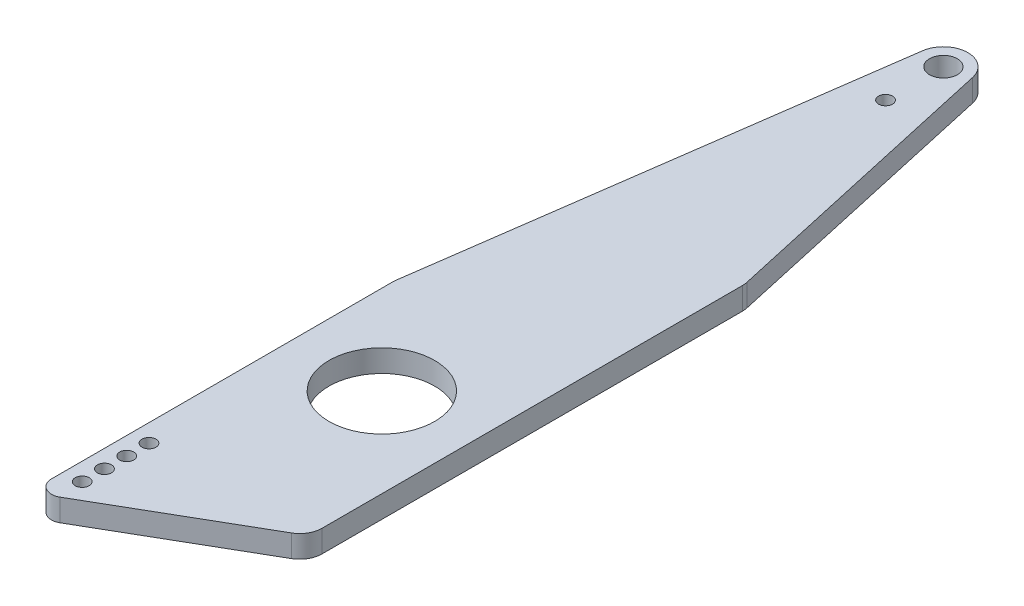
from build123d import *

# Parameters (mm, degrees)
SKETCH1_R           = 3.96875
SKETCH1_R_2         = 15.08125
SKETCH1_R_3         = 2
BOSS_EXTRUDE1_DEPTH = 6.35


with BuildPart() as part:
    # Sketch1 → Boss-Extrude1 (new body)
    with BuildSketch(Plane(origin=(0, 0, 0), x_dir=(1, 0, 0), z_dir=(0, 1, 0))):
        with BuildLine():
            Line((25.4, -82.735721877), (25.4, -202.708825791))
            ThreePointArc((25.4, -202.708825791), (24.549261314, -205.883825791), (22.225, -208.208087105))
            Line((22.225, -208.208087105), (-19.685, -232.404836886))
            ThreePointArc((-19.685, -232.404836886), (-23.495, -232.404836886), (-25.4, -229.105280098))
            Line((-25.4, -229.105280098), (-25.4, -131.278691098))
            Line((-25.4, -131.278691098), (-6.917767735, 0.966806375))
            ThreePointArc((-6.917767735, 0.966806375), (-0.279220673, 6.97941694), (6.818426198, 1.51634072))
            Line((6.818426198, 1.51634072), (25.248569271, -81.357230313))
            ThreePointArc((25.248569271, -81.357230313), (25.362028789, -82.042329806), (25.4, -82.735721877))
        make_face()
        with Locations(Location((0, 0, 0), (0, 0, 270))):
            Circle(SKETCH1_R, mode=Mode.SUBTRACT)
        with Locations(Location((0, -160.246508934, 0), (0, 0, 270))):
            Circle(SKETCH1_R_2, mode=Mode.SUBTRACT)
        with Locations(Location((-20.32, -225.425, 0), (0, 0, 270))):
            Circle(SKETCH1_R_3, mode=Mode.SUBTRACT)
        with Locations(Location((-20.32, -219.075, 0), (0, 0, 270))):
            Circle(SKETCH1_R_3, mode=Mode.SUBTRACT)
        with Locations(Location((-20.32, -212.725, 0), (0, 0, 270))):
            Circle(SKETCH1_R_3, mode=Mode.SUBTRACT)
        with Locations(Location((-20.32, -206.375, 0), (0, 0, 270))):
            Circle(SKETCH1_R_3, mode=Mode.SUBTRACT)
        with Locations(Location((0, -16.51, 0), (0, 0, 270))):
            Circle(SKETCH1_R_3, mode=Mode.SUBTRACT)
    extrude(amount=-BOSS_EXTRUDE1_DEPTH)


solid = part.part
